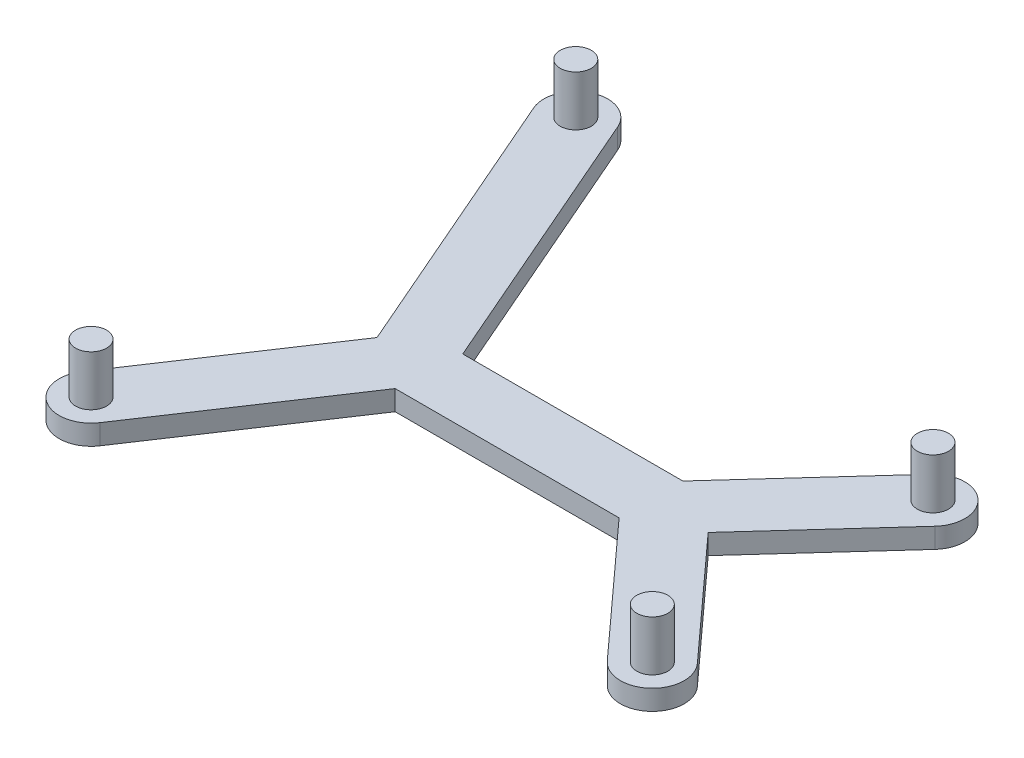
from build123d import *

# Parameters (mm, degrees)
SKETCH1_R             = 1.55
BOSS_EXTRUDE1_DEPTH   = 5
BOSS_EXTRUDE1_2_DEPTH = 5
BOSS_EXTRUDE1_3_DEPTH = 5
BOSS_EXTRUDE1_4_DEPTH = 5
BOSS_EXTRUDE2_DEPTH   = 2


with BuildPart() as part:
    # Sketch1 → Boss-Extrude1 (new body)
    with BuildSketch(Plane(origin=(0, 0, 0), x_dir=(1, 0, 0), z_dir=(0, 1, 0))):
        with Locations((15.24, -50.8)):
            Circle(SKETCH1_R)
    extrude(amount=BOSS_EXTRUDE1_DEPTH)


with BuildPart() as body_2:
    # Sketch1 → Boss-Extrude1 2 (new body)
    with BuildSketch(Plane(origin=(0, 0, 0), x_dir=(1, 0, 0), z_dir=(0, 1, 0))):
        with Locations((15.24, -2.54)):
            Circle(SKETCH1_R)
    extrude(amount=BOSS_EXTRUDE1_2_DEPTH)


with BuildPart() as body_3:
    # Sketch1 → Boss-Extrude1 3 (new body)
    with BuildSketch(Plane(origin=(0, 0, 0), x_dir=(1, 0, 0), z_dir=(0, 1, 0))):
        with Locations((66.04, -17.78)):
            Circle(SKETCH1_R)
    extrude(amount=BOSS_EXTRUDE1_3_DEPTH)


with BuildPart() as body_4:
    # Sketch1 → Boss-Extrude1 4 (new body)
    with BuildSketch(Plane(origin=(0, 0, 0), x_dir=(1, 0, 0), z_dir=(0, 1, 0))):
        with Locations((66.04, -45.72)):
            Circle(SKETCH1_R)
    extrude(amount=BOSS_EXTRUDE1_4_DEPTH)


with BuildPart() as body_5:
    # Sketch1<3> → Boss-Extrude2 (new body)
    with BuildSketch(Plane(origin=(0, 0, 0), x_dir=(1, 0, 0), z_dir=(0, 1, 0))):
        with BuildLine():
            ThreePointArc((18.151697429, -1.274044596), (13.974044596, 0.371697429), (12.328302571, -3.805955404))
            Line((12.328302571, -3.805955404), (24.338244174, -31.428821089))
            Line((24.338244174, -31.428821089), (12.598240315, -49.038826877))
            ThreePointArc((12.598240315, -49.038826877), (13.478826877, -53.441759685), (17.881759685, -52.561173123))
            Line((17.881759685, -52.561173123), (29.639208433, -34.925))
            Line((29.639208433, -34.925), (51.935475612, -34.925))
            Line((51.935475612, -34.925), (63.690690267, -47.855736121))
            ThreePointArc((63.690690267, -47.855736121), (68.175736121, -48.069309733), (68.389309733, -43.584263879))
            Line((68.389309733, -43.584263879), (57.630888025, -31.75))
            Line((57.630888025, -31.75), (68.389309733, -19.915736121))
            ThreePointArc((68.389309733, -19.915736121), (68.175736121, -15.430690267), (63.690690267, -15.644263879))
            Line((63.690690267, -15.644263879), (51.935475612, -28.575))
            Line((51.935475612, -28.575), (30.021678039, -28.575))
            Line((30.021678039, -28.575), (18.151697429, -1.274044596))
        make_face()
    extrude(amount=-BOSS_EXTRUDE2_DEPTH)


solid = Compound([part.part, body_2.part, body_3.part, body_4.part, body_5.part])
